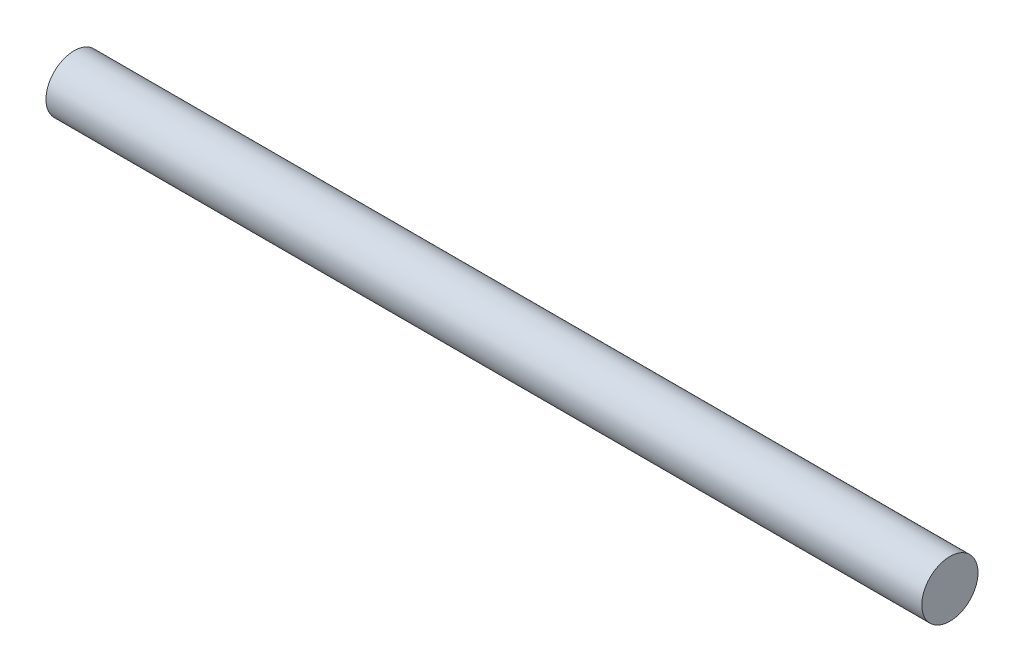
from build123d import *

# Parameters (mm, degrees)
SKETCH2_R           = 2.5
BOSS_EXTRUDE1_DEPTH = 74.8
MOVE_FACE1_BY       = 0.1


with BuildPart() as part:
    # Sketch2 → Boss-Extrude1 (new body)
    with BuildSketch(Plane(origin=(0, 0, 0), x_dir=(0, 0, -1), z_dir=(1, 0, 0))):
        Circle(SKETCH2_R)
    extrude(amount=BOSS_EXTRUDE1_DEPTH)

    # Move Face1: a curved face moved inward by 0.1
    add(Solid.thicken(part.faces().sort_by_distance((37.4, 0, 2.5))[0], -MOVE_FACE1_BY), mode=Mode.SUBTRACT)


solid = part.part
